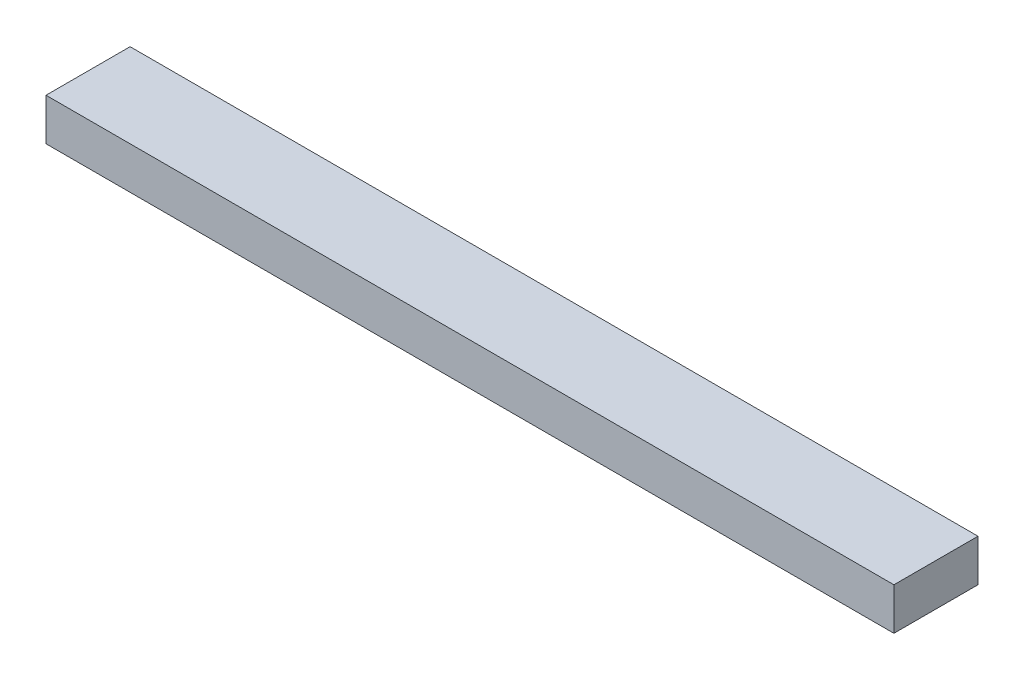
from build123d import *

# Parameters (mm, degrees)
ESQUISSE1_W        = 121
ESQUISSE1_H        = 12
BOSS_EXTRU_1_DEPTH = 6


with BuildPart() as part:
    # Esquisse1 → Boss.-Extru.1 (new body)
    with BuildSketch(Plane(origin=(0, 0, 0), x_dir=(1, 0, 0), z_dir=(0, 1, 0))):
        Rectangle(ESQUISSE1_W, ESQUISSE1_H)
    extrude(amount=BOSS_EXTRU_1_DEPTH)


solid = part.part
